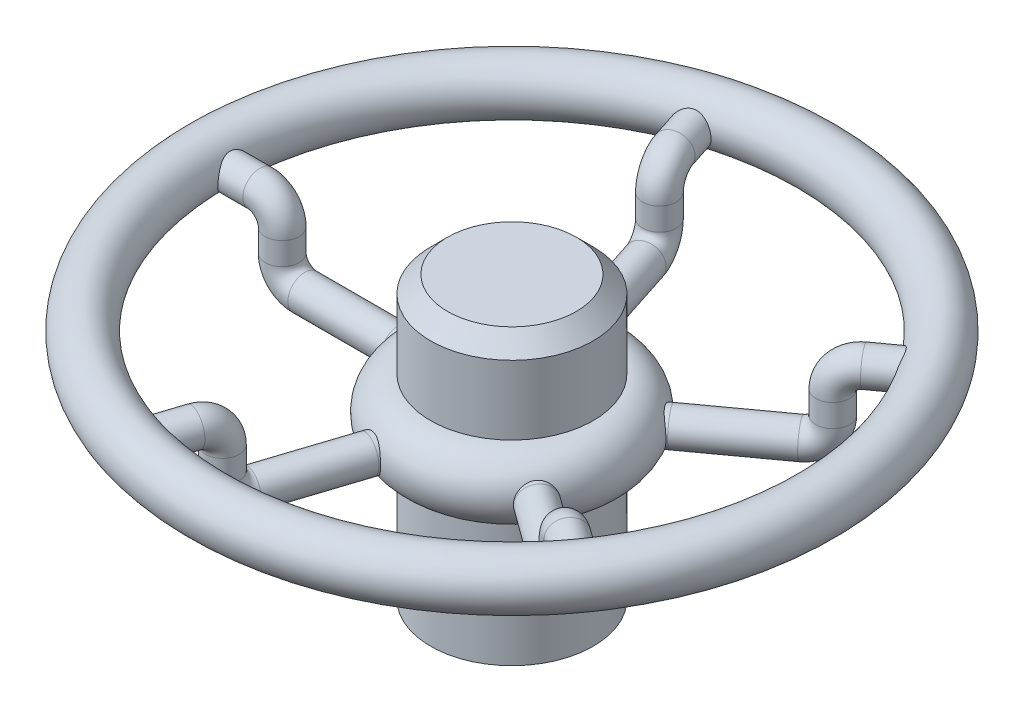
from build123d import *
from build123d.topology import SkipClean

# Parameters (mm, degrees)
SWEEP3_PROFILE_R    = 7.5
CIRPATTERN2_COUNT   = 5
SKETCH39_R          = 11.585912947
BOSS_EXTRUDE3_START = 27
SKETCH40_R          = 36.152799581
BOSS_EXTRUDE3_DEPTH = 27
SKETCH42_R          = 19.2298427
CUT_EXTRUDE5_DEPTH  = 27
SKETCH43_R          = 9.353503747
CUT_EXTRUDE6_DEPTH  = 27


with BuildPart() as part:
    # Sketch1 → Revolve1 (revolve)
    with BuildSketch(Plane.XY):
        with BuildLine():
            Line((0, 0), (0, 35.112431248))
            Line((0, 35.112431248), (-28.610129165, 35.112431248))
            Line((-28.610129165, 35.112431248), (-36.152799581, 27.569760832))
            Line((-36.152799581, 27.569760832), (-36.152799581, -3.121105))
            ThreePointArc((-36.152799581, -3.121105), (-50.717956247, -17.686261666), (-36.152799581, -32.251418332))
            Line((-36.152799581, -32.251418332), (-36.152799581, -62.942284163))
            Line((-36.152799581, -62.942284163), (0, -62.942284163))
            Line((0, -62.942284163), (0, 0))
        make_face()
    revolve(axis=Axis((0, -62.942284163, 0), (0, 1, 0)))

    # Sweep3: sweep along a path in Sketch2
    with BuildLine(Plane.XY) as sweep3_path:
        Line((0, -17.686261666), (-50.717956247, -17.686261666))
        Line((-50.717956247, -17.686261666), (-92.075611194, -17.686261666))
        ThreePointArc((-92.075611194, -17.686261666), (-99.146679005, -14.757329478), (-102.075611194, -7.686261666))
        Line((-102.075611194, -7.686261666), (-102.075611194, 2.341573715))
        ThreePointArc((-102.075611194, 2.341573715), (-105.004543382, 9.412641527), (-112.075611194, 12.341573715))
        Line((-112.075611194, 12.341573715), (-134.886627506, 12.341573715))
    # Sweep3 profile (on start of the path) → Sweep3 (sweep)
    with BuildSketch(Plane(origin=(0, -17.686261666, 0), x_dir=(0, -1, 0), z_dir=(-1, 0, 0))):
        Circle(SWEEP3_PROFILE_R)
    sweep3 = sweep(path=sweep3_path.line)

    # CirPattern2: Sweep3 ×5 about axis
    with SkipClean():  # the faces are left unmerged after this step: merging them gives an invalid solid
        cirpattern2_axis = Axis((0, -62.942284163, 0), (0, -1, 0))
        for i in range(1, CIRPATTERN2_COUNT):
            add(sweep3.rotate(cirpattern2_axis, i * 360 / CIRPATTERN2_COUNT))

    # Sketch39 → Revolve3 (revolve)
    with SkipClean():  # the faces are left unmerged after this step: merging them gives an invalid solid
        with BuildSketch(Plane.XY):
            with Locations((-134.886627506, 13.321597347)):
                Circle(SKETCH39_R)
        revolve(axis=Axis((0, -62.942284163, 0), (0, 1, 0)))

    # Sketch40 → Boss-Extrude3 (add)
    with SkipClean():  # the faces are left unmerged after this step: merging them gives an invalid solid
        with BuildSketch(Plane.XZ.offset(62.942284163).offset(BOSS_EXTRUDE3_START)):
            Circle(SKETCH40_R)
        extrude(amount=-BOSS_EXTRUDE3_DEPTH)

    # Sketch42 → Cut-Extrude5 (cut)
    with SkipClean():  # the faces are left unmerged after this step: merging them gives an invalid solid
        with BuildSketch(Plane.XZ.offset(89.942284163)):
            Circle(SKETCH42_R)
        extrude(amount=-CUT_EXTRUDE5_DEPTH, mode=Mode.SUBTRACT)

    # Sketch43 → Cut-Extrude6 (cut)
    with SkipClean():  # the faces are left unmerged after this step: merging them gives an invalid solid
        with BuildSketch(Plane.XZ.offset(62.942284163)):
            Circle(SKETCH43_R)
        extrude(amount=-CUT_EXTRUDE6_DEPTH, mode=Mode.SUBTRACT)


solid = part.part
